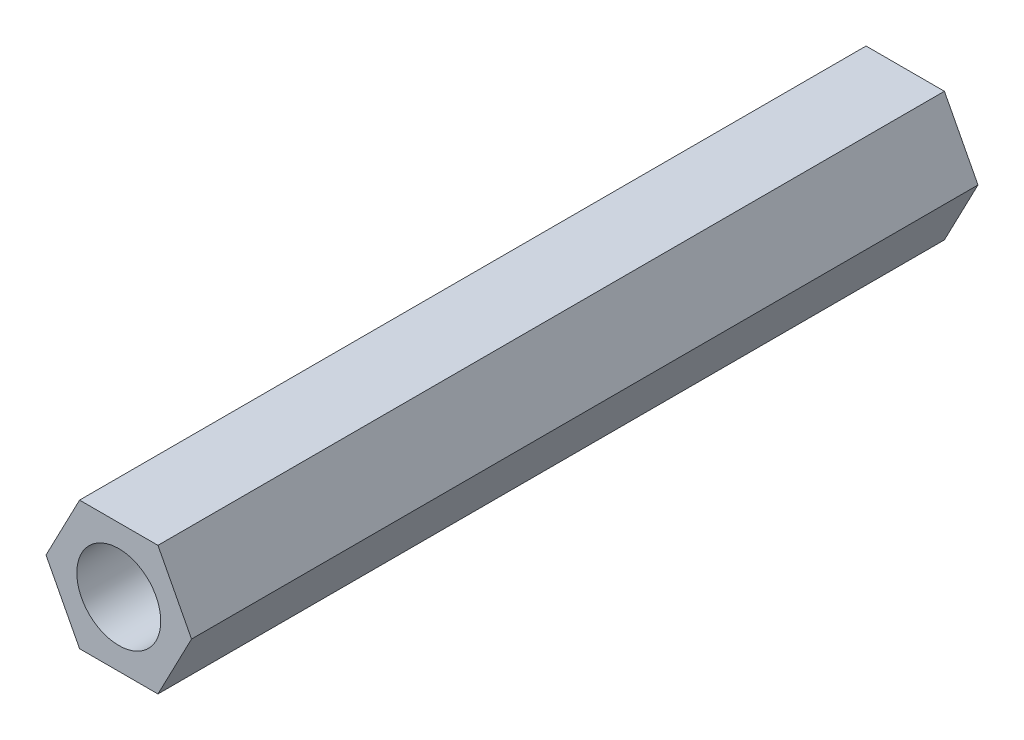
from build123d import *

# Parameters (mm, degrees)
BOSS_EXTRUDE1_DEPTH = 28.1
SKETCH2_R           = 1.5
CUT_EXTRUDE1_DEPTH  = 2
CUT_EXTRUDE2_START  = -3
SKETCH3_R           = 1.5
CUT_EXTRUDE2_DEPTH  = 3


with BuildPart() as part:
    # Sketch1 → Boss-Extrude1 (new body)
    with BuildSketch(Plane.XY):
        Polygon((-1.4, 4.6), (1.4, 4.6), (2.599787383, 2.3), (1.4, 0), (-1.4, 0), (-2.599787383, 2.3), align=None)
    extrude(amount=BOSS_EXTRUDE1_DEPTH)

    # Sketch2 → Cut-Extrude1 (cut)
    with BuildSketch(Plane(origin=(0, 0, 0), x_dir=(-1, 0, 0), z_dir=(0, 0, -1))):
        with Locations((0, 2.3)):
            Circle(SKETCH2_R)
    extrude(amount=-CUT_EXTRUDE1_DEPTH, mode=Mode.SUBTRACT)

    # Sketch3 → Cut-Extrude2 (cut)
    with BuildSketch(Plane.XY.offset(28.1).offset(CUT_EXTRUDE2_START)):
        with Locations(Location((0, 2.3, 0), (0, 0, 180))):
            Circle(SKETCH3_R)
    extrude(amount=CUT_EXTRUDE2_DEPTH, mode=Mode.SUBTRACT)


solid = part.part
